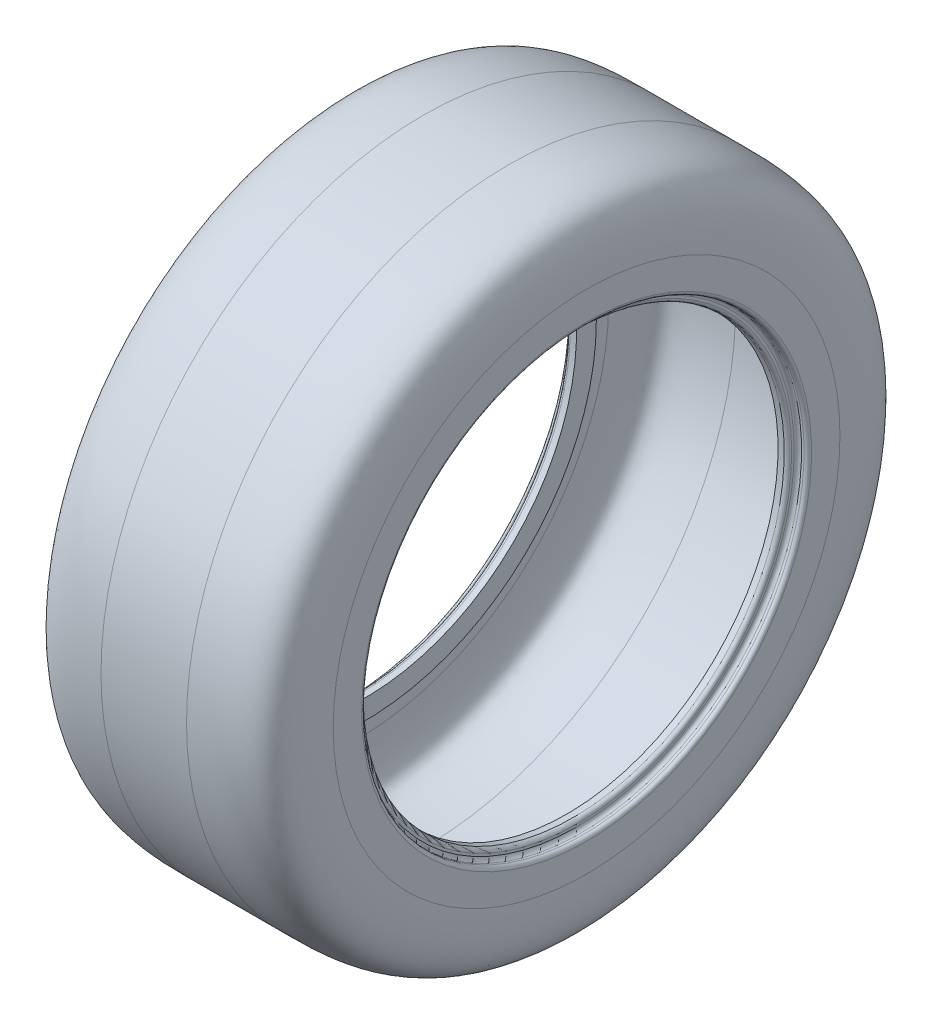
from build123d import *

# Parameters (mm, degrees)
FILLET1_R = 2.9972
FILLET2_R = 2.9972


with BuildPart() as part:
    # Sketch1 → Revolve1 (revolve)
    with BuildSketch(Plane.XY, mode=Mode.PRIVATE) as revolve1_sk:
        with BuildLine():
            Line((0, 260.35), (-34.544, 260.35))
            add(Edge.make_bspline(
                [(-34.544, 260.35), (-54.238036278, 260.35), (-96.843679126, 260.294718787), (-97.409, 229.201245204), (-97.409, 204.6732)],
                knots=[0, 0, 0, 0, 0.50043937, 1, 1, 1, 1], degree=3))
            Line((-97.409, 204.6732), (-97.409, 178.689))
            Line((-97.409, 178.689), (-89.408, 178.689))
            Line((-89.408, 178.689), (-89.408, 170.688))
            Line((-89.408, 170.688), (-81.407, 170.688))
            Line((-81.407, 170.688), (-81.407, 178.689))
            Line((-81.407, 178.689), (-81.407, 186.69))
            Line((-81.407, 186.69), (-89.408, 186.69))
            Line((-89.408, 186.69), (-89.408, 204.6732))
            add(Edge.make_bspline(
                [(-34.544, 252.349), (-37.003983488, 252.349), (-41.937901553, 252.34793327), (-51.693986408, 252.224589007), (-60.9755731, 251.743940548), (-69.096662341, 250.61667717), (-74.401284141, 249.41283137), (-78.22362839, 248.033037193), (-80.618219979, 246.772714257), (-82.368054269, 245.565614045), (-83.9698243, 244.024418961), (-85.579571502, 241.661292123), (-87.003106979, 238.226642631), (-88.102667871, 233.669585184), (-88.837391939, 227.999934294), (-89.174906946, 222.394259863), (-89.320800993, 217.405548766), (-89.381114027, 213.418121806), (-89.401672217, 209.888037485), (-89.407448129, 206.953602566), (-89.408, 205.428511481), (-89.408, 204.6732)],
                knots=[0, 0, 0, 0, 0.0625, 0.125, 0.25, 0.3125, 0.375, 0.4375, 0.478344457, 0.509594457, 0.5625, 0.625, 0.6875, 0.75, 0.8125, 0.875, 0.90625, 0.9375, 0.96875, 0.984375, 1, 1, 1, 1], degree=3))
            Line((-34.544, 252.349), (-8.001, 252.349))
            Line((-8.001, 252.349), (0, 252.349))
            Line((0, 252.349), (0, 260.35))
        make_face()
    revolve1 = revolve(revolve1_sk.sketch.rotate(Axis((-120.106742896, 0, 0), (1, 0, 0)), 90), axis=Axis((-120.106742896, 0, 0), (1, 0, 0)))

    # Fillet1
    fillet1_edges = [part.edges().sort_by_distance(p)[0] for p in [
        (-97.409, 0, -178.689),
        (-89.408, 0, -178.689),
        (-89.408, 0, -170.688),
    ]]
    fillet(fillet1_edges, radius=FILLET1_R)

    # Mirror1: Revolve1 across Right Plane
    add(revolve1.mirror(Plane(origin=(0, 0, 0), x_dir=(0, 0, -1), z_dir=(1, 0, 0))))

    # Fillet2
    fillet2_edges = [part.edges().sort_by_distance(p)[0] for p in [
        (89.408, 0, -170.688),
        (89.408, 0, -178.689),
        (97.409, 0, -178.689),
    ]]
    fillet(fillet2_edges, radius=FILLET2_R)


solid = part.part
